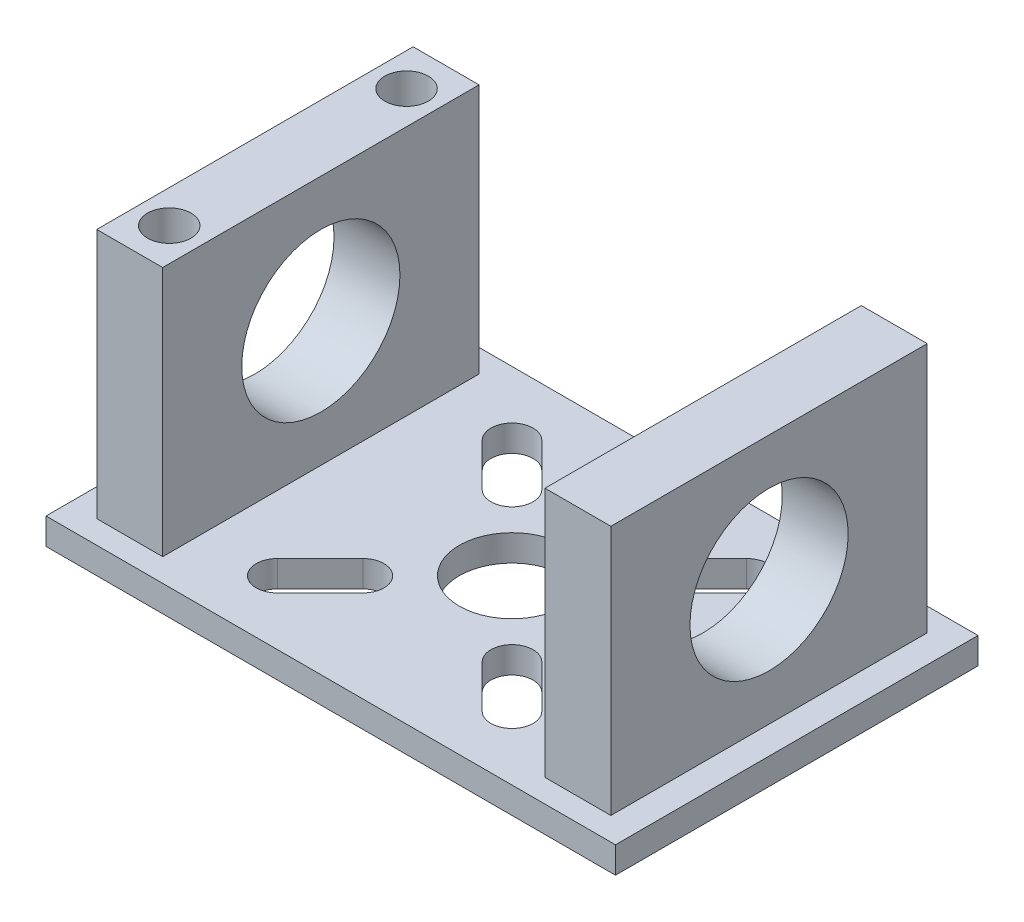
from build123d import *

# Parameters (mm, degrees)
SKETCH_1_W               = 43.2
SKETCH_1_H               = 27.5
EXTRUDE_1_DEPTH          = 2
CUT_EXTRUDE_1_REACH      = 27.683
SKETCH_2_R               = 1.65
CUT_EXTRUDE_2_REACH      = 27.683
MIRROR_2_COPY_1_REACH    = 27.683
MIRROR_2_COPY_1_SKETCH_R = 1.65
MIRROR_2_COPY_2_REACH    = 27.683
CUT_EXTRUDE_3_REACH      = 27.683
SKETCH_4_R               = 4
SKETCH_5_W               = 5
SKETCH_5_H               = 24
EXTRUDE_2_DEPTH          = 19
CUT_EXTRUDE_5_REACH      = 50.159
SKETCH_6_R               = 6
CUT_EXTRUDE_6_REACH      = 35.115
SKETCH_7_R               = 1.65


with BuildPart() as part:
    # 草图1 → 凸台-拉伸1 (new body)
    with BuildSketch(Plane(origin=(0, 0, 0), x_dir=(1, 0, 0), z_dir=(0, 1, 0))):
        Rectangle(SKETCH_1_W, SKETCH_1_H)
    extrude(amount=EXTRUDE_1_DEPTH)

    # 草图2 → 切除-拉伸1 (cut, up to next)
    with BuildSketch(Plane(origin=(0, 2, 0), x_dir=(1, 0, 0), z_dir=(0, 1, 0)), mode=Mode.PRIVATE) as cut_extrude_1_sk1:
        with Locations(Location((-17, 9, 0), (0, 0, 270))):
            Circle(SKETCH_2_R)
    cut_extrude_1_tool1 = extrude(cut_extrude_1_sk1.sketch, amount=-CUT_EXTRUDE_1_REACH, mode=Mode.PRIVATE) & part.part
    cut_extrude_1 = cut_extrude_1_tool1.solids().sort_by_distance((-17, 2, -9))[0]
    add(cut_extrude_1, mode=Mode.SUBTRACT)

    # 草图3 → 切除-拉伸2 (cut, up to next)
    with BuildSketch(Plane(origin=(0, 2, 0), x_dir=(1, 0, 0), z_dir=(0, 1, 0)), mode=Mode.PRIVATE) as cut_extrude_2_sk1:
        with BuildLine():
            Line((-6.788225099, 4.5254834), (-10.033845225, 7.771103525))
            ThreePointArc((-10.033845225, 7.771103525), (-10.033845225, 10.033845225), (-7.771103525, 10.033845225))
            Line((-7.771103525, 10.033845225), (-4.5254834, 6.788225099))
            ThreePointArc((-4.5254834, 6.788225099), (-4.5254834, 4.5254834), (-6.788225099, 4.5254834))
        make_face()
    cut_extrude_2_tool1 = extrude(cut_extrude_2_sk1.sketch, amount=-CUT_EXTRUDE_2_REACH, mode=Mode.PRIVATE) & part.part
    cut_extrude_2 = cut_extrude_2_tool1.solids().sort_by_distance((-7.279664, 2, -7.279664))[0]
    add(cut_extrude_2, mode=Mode.SUBTRACT)

    # 镜向1: 切除-拉伸1, 切除-拉伸2 across plane
    add(cut_extrude_1.mirror(Plane.XY), mode=Mode.SUBTRACT)
    add(cut_extrude_2.mirror(Plane.XY), mode=Mode.SUBTRACT)

    # 镜向2: 切除-拉伸1, 切除-拉伸2 across plane
    add(cut_extrude_1.mirror(Plane(origin=(0, 0, 0), x_dir=(0, 0, 1), z_dir=(1, 0, 0))), mode=Mode.SUBTRACT)
    add(cut_extrude_2.mirror(Plane(origin=(0, 0, 0), x_dir=(0, 0, 1), z_dir=(1, 0, 0))), mode=Mode.SUBTRACT)

    # 镜向2 copy 1 sketch → 镜向2 copy 1 (cut, up to next)
    with BuildSketch(Plane(origin=(0, 2, 0), x_dir=(-1, 0, 0), z_dir=(0, 1, 0)), mode=Mode.PRIVATE) as mirror_2_copy_1_sk1:
        with Locations(Location((-17, 9, 0), (0, 0, 270))):
            Circle(MIRROR_2_COPY_1_SKETCH_R)
    mirror_2_copy_1_tool1 = extrude(mirror_2_copy_1_sk1.sketch, amount=-MIRROR_2_COPY_1_REACH, mode=Mode.PRIVATE) & part.part
    add(mirror_2_copy_1_tool1.solids().sort_by_distance((17, 2, 9))[0], mode=Mode.SUBTRACT)

    # 镜向2 copy 2 sketch → 镜向2 copy 2 (cut, up to next)
    with BuildSketch(Plane(origin=(0, 2, 0), x_dir=(-1, 0, 0), z_dir=(0, 1, 0)), mode=Mode.PRIVATE) as mirror_2_copy_2_sk1:
        with BuildLine():
            Line((-6.788225099, 4.5254834), (-10.033845225, 7.771103525))
            ThreePointArc((-10.033845225, 7.771103525), (-10.033845225, 10.033845225), (-7.771103525, 10.033845225))
            Line((-7.771103525, 10.033845225), (-4.5254834, 6.788225099))
            ThreePointArc((-4.5254834, 6.788225099), (-4.5254834, 4.5254834), (-6.788225099, 4.5254834))
        make_face()
    mirror_2_copy_2_tool1 = extrude(mirror_2_copy_2_sk1.sketch, amount=-MIRROR_2_COPY_2_REACH, mode=Mode.PRIVATE) & part.part
    add(mirror_2_copy_2_tool1.solids().sort_by_distance((7.279664, 2, 7.279664))[0], mode=Mode.SUBTRACT)

    # 草图4 → 切除-拉伸3 (cut, up to next)
    with BuildSketch(Plane(origin=(0, 2, 0), x_dir=(1, 0, 0), z_dir=(0, 1, 0)), mode=Mode.PRIVATE) as cut_extrude_3_sk1:
        with Locations(Location((0, 0, 0), (0, 0, 270))):
            Circle(SKETCH_4_R)
    cut_extrude_3_tool1 = extrude(cut_extrude_3_sk1.sketch, amount=-CUT_EXTRUDE_3_REACH, mode=Mode.PRIVATE) & part.part
    add(cut_extrude_3_tool1.solids().sort_by_distance((0, 2, 0))[0], mode=Mode.SUBTRACT)

    # 草图5 → 凸台-拉伸2 (add)
    with BuildSketch(Plane(origin=(0, 2, 0), x_dir=(1, 0, 0), z_dir=(0, 1, 0))):
        with Locations((-17, 0)):
            Rectangle(SKETCH_5_W, SKETCH_5_H)
    extrude_2 = extrude(amount=EXTRUDE_2_DEPTH)

    # 草图6 → 切除-拉伸5 (cut, up to next)
    with BuildSketch(Plane.ZY.offset(19.5), mode=Mode.PRIVATE) as cut_extrude_5_sk1:
        with Locations((0, 11.5)):
            Circle(SKETCH_6_R)
    cut_extrude_5_tool1 = extrude(cut_extrude_5_sk1.sketch, amount=-CUT_EXTRUDE_5_REACH, mode=Mode.PRIVATE) & part.part
    cut_extrude_5 = cut_extrude_5_tool1.solids().sort_by_distance((-19.5, 11.5, 0))[0]
    add(cut_extrude_5, mode=Mode.SUBTRACT)

    # 草图7 → 切除-拉伸6 (cut, up to next)
    with BuildSketch(Plane.XZ, mode=Mode.PRIVATE) as cut_extrude_6_sk1:
        with Locations(Location((-17, 9, 0), (0, 0, 270))):
            Circle(SKETCH_7_R)
    cut_extrude_6_tool1 = extrude(cut_extrude_6_sk1.sketch, amount=-CUT_EXTRUDE_6_REACH, mode=Mode.PRIVATE) & part.part
    # 草图7 → 切除-拉伸6 (cut, up to next)
    with BuildSketch(Plane.XZ, mode=Mode.PRIVATE) as cut_extrude_6_sk2:
        with Locations(Location((-17, -9, 0), (0, 0, 270))):
            Circle(SKETCH_7_R)
    cut_extrude_6_tool2 = extrude(cut_extrude_6_sk2.sketch, amount=-CUT_EXTRUDE_6_REACH, mode=Mode.PRIVATE) & part.part
    add(cut_extrude_6_tool1.solids().sort_by_distance((-17, 0, 9))[0], mode=Mode.SUBTRACT)
    add(cut_extrude_6_tool2.solids().sort_by_distance((-17, 0, -9))[0], mode=Mode.SUBTRACT)

    # 镜向3: 切除-拉伸1, 凸台-拉伸2, 切除-拉伸5 across plane
    add(cut_extrude_1.mirror(Plane(origin=(0, 0, 0), x_dir=(0, 0, 1), z_dir=(1, 0, 0))), mode=Mode.SUBTRACT)
    add(extrude_2.mirror(Plane(origin=(0, 0, 0), x_dir=(0, 0, 1), z_dir=(1, 0, 0))))
    add(cut_extrude_5.mirror(Plane(origin=(0, 0, 0), x_dir=(0, 0, 1), z_dir=(1, 0, 0))), mode=Mode.SUBTRACT)


solid = part.part
